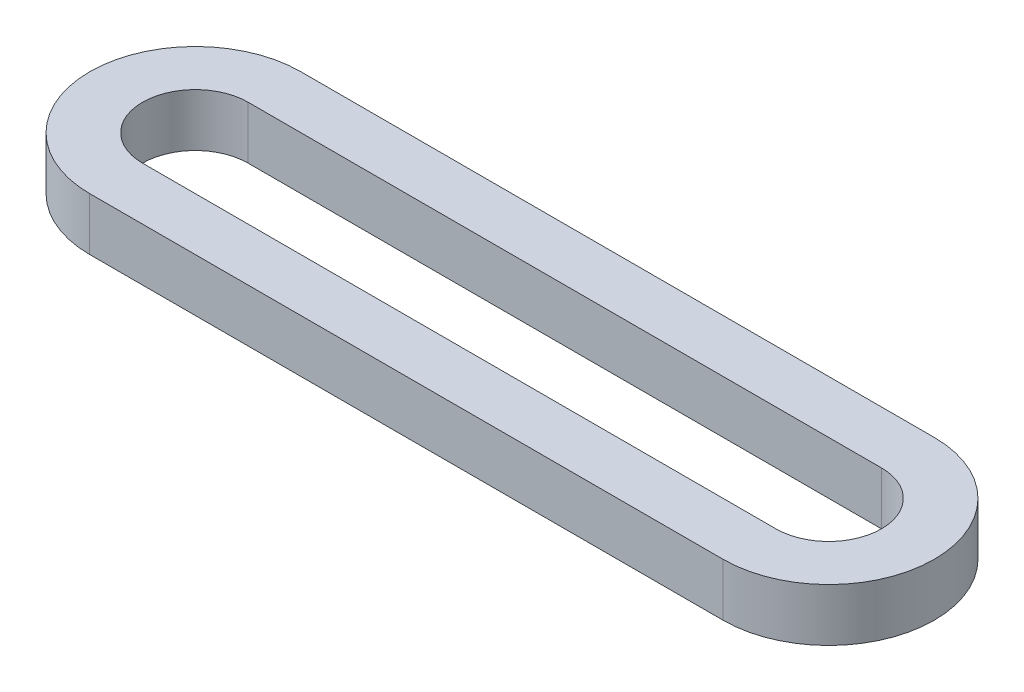
from build123d import *

# Parameters (mm, degrees)
BOSS_EXTRUDE1_DEPTH = 3.175


with BuildPart() as part:
    # Sketch1 → Boss-Extrude1 (new body)
    with BuildSketch(Plane(origin=(0, 0, 0), x_dir=(1, 0, 0), z_dir=(0, 1, 0))):
        with BuildLine():
            Line((0, -6.35), (-38.1, -6.35))
            ThreePointArc((-38.1, -6.35), (-44.45, 0), (-38.1, 6.35))
            Line((-38.1, 6.35), (0, 6.35))
            ThreePointArc((0, 6.35), (6.35, 0), (0, -6.35))
        make_face()
        with BuildLine():
            Line((0, -3.175), (-38.1, -3.175))
            ThreePointArc((-38.1, -3.175), (-41.275, 0), (-38.1, 3.175))
            Line((-38.1, 3.175), (0, 3.175))
            ThreePointArc((0, 3.175), (3.175, 0), (0, -3.175))
        make_face(mode=Mode.SUBTRACT)
    extrude(amount=BOSS_EXTRUDE1_DEPTH)


solid = part.part
